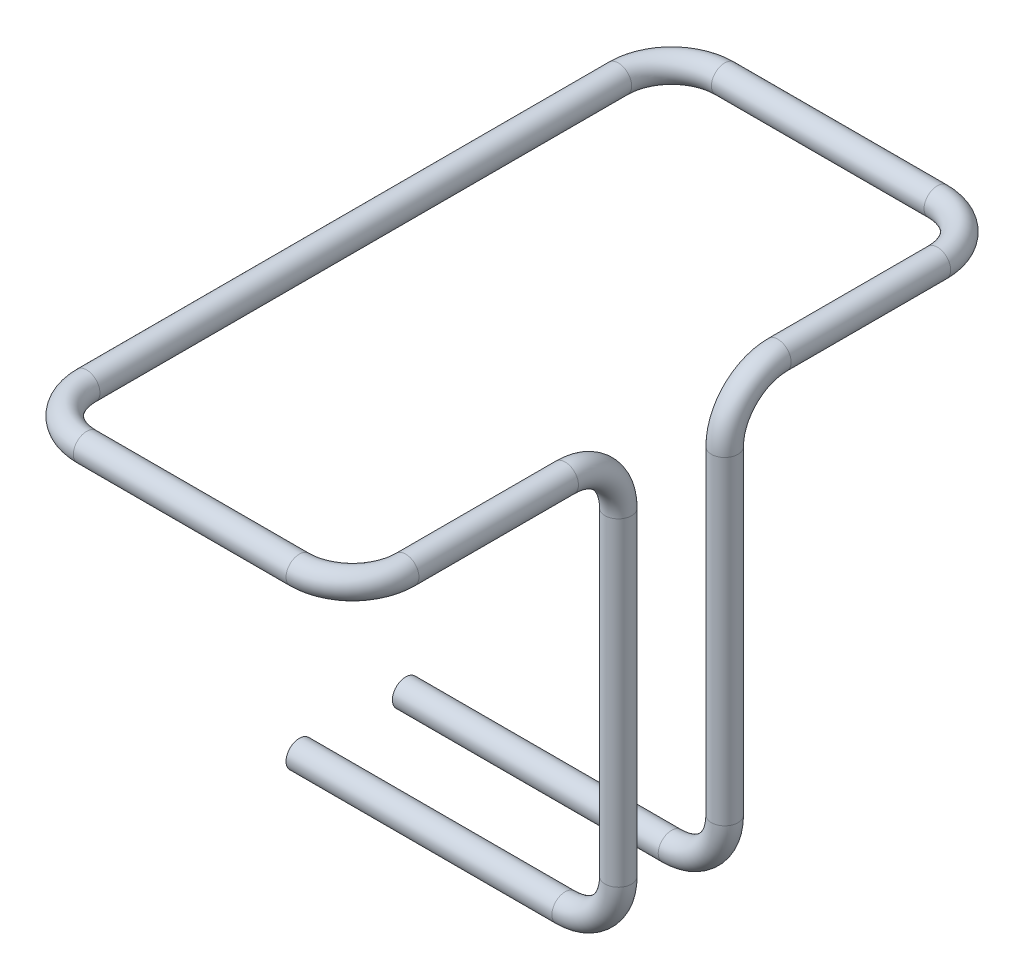
from build123d import *

# Parameters (mm, degrees)
SWEEP1_PROFILE_R = 3.175


with BuildPart() as part:
    # Sweep1: sweep along a curve in space
    with BuildLine() as sweep1_path:
        Line((-12.7, 0, 25.4), (-76.2, 0, 25.4))
        ThreePointArc((-12.7, 0, 25.4), (-3.719743879, 3.719743879, 25.4), (0, 12.7, 25.4))
        Line((0, 12.7, 25.4), (0, 88.9, 25.4))
        ThreePointArc((0, 88.9, 25.4), (0, 97.880256121, 29.119743879), (0, 101.6, 38.1))
        Line((0, 101.6, 38.1), (0, 101.6, 76.2))
        ThreePointArc((0, 101.6, 76.2), (-3.719743879, 101.6, 85.180256121), (-12.7, 101.6, 88.9))
        Line((-12.7, 101.6, 88.9), (-63.5, 101.6, 88.9))
        ThreePointArc((-63.5, 101.6, 88.9), (-72.480256121, 101.6, 85.180256121), (-76.2, 101.6, 76.2))
        Line((-76.2, 101.6, 76.2), (-76.2, 101.6, -50.8))
        ThreePointArc((-76.2, 101.6, -50.8), (-72.480256121, 101.6, -59.780256121), (-63.5, 101.6, -63.5))
        Line((-63.5, 101.6, -63.5), (-12.7, 101.6, -63.5))
        ThreePointArc((0, 101.6, -50.8), (-3.719743879, 101.6, -59.780256121), (-12.7, 101.6, -63.5))
        Line((0, 101.6, -12.7), (0, 101.6, -50.8))
        ThreePointArc((0, 88.9, 0), (0, 97.880256121, -3.719743879), (0, 101.6, -12.7))
        Line((0, 12.7, 0), (0, 88.9, 0))
        ThreePointArc((-12.7, 0, 0), (-3.719743879, 3.719743879, 0), (0, 12.7, 0))
        Line((-12.7, 0, 0), (-76.2, 0, 0))
    # Sweep1 profile (on start of the path) → Sweep1 (sweep)
    with BuildSketch(Plane(origin=(-76.2, 0, 0), x_dir=(0, 0, 1), z_dir=(1, 0, 0))):
        Circle(SWEEP1_PROFILE_R)
    sweep(path=sweep1_path.line)


solid = part.part
